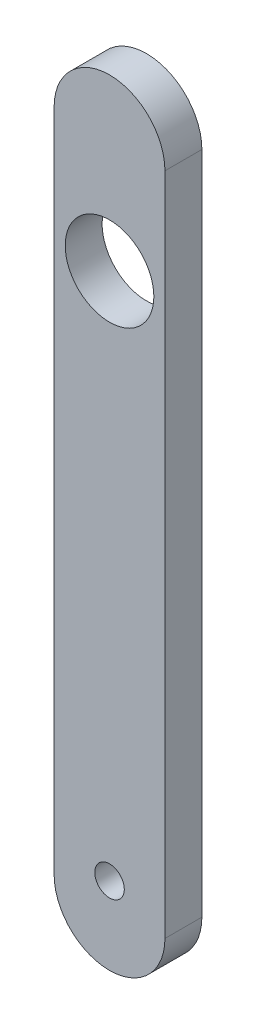
from build123d import *

# Parameters (mm, degrees)
ESBO_O1_R                = 2
ESBO_O1_R_2              = 6
RESSALTO_EXTRUS_O1_DEPTH = 5


with BuildPart() as part:
    # Esboço1 → Ressalto-extrusão1 (new body)
    with BuildSketch(Plane.XY):
        with BuildLine():
            Line((0, 0), (0, 90))
            ThreePointArc((0, 90), (7.5, 97.5), (15, 90))
            Line((15, 90), (15, 0))
            ThreePointArc((15, 0), (7.5, -7.5), (0, 0))
        make_face()
        with Locations((7.5, 3)):
            Circle(ESBO_O1_R, mode=Mode.SUBTRACT)
        with Locations((7.5, 74.5)):
            Circle(ESBO_O1_R_2, mode=Mode.SUBTRACT)
    extrude(amount=RESSALTO_EXTRUS_O1_DEPTH)


solid = part.part
